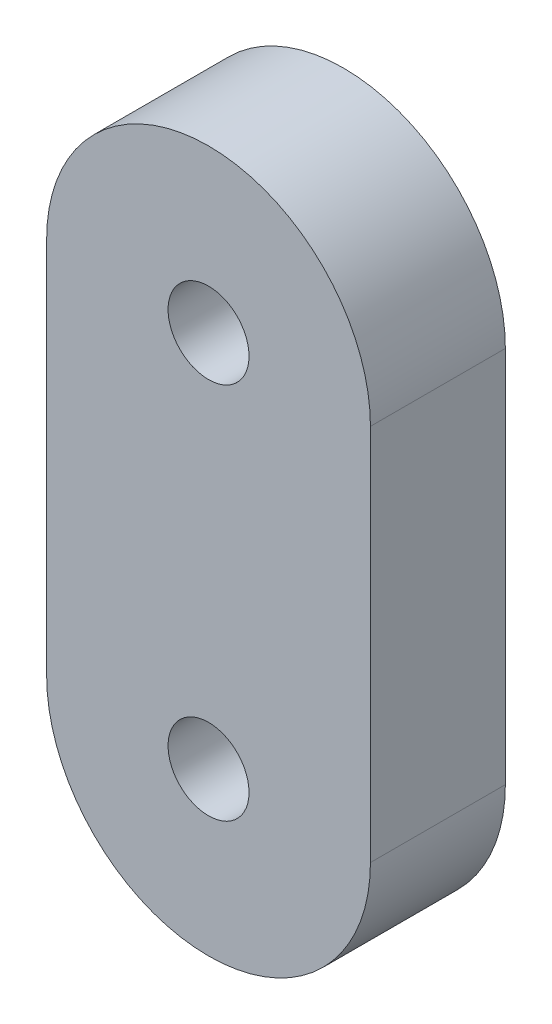
from build123d import *

# Parameters (mm, degrees)
SKETCH1_R           = 1.5
BOSS_EXTRUDE1_DEPTH = 5


with BuildPart() as part:
    # Sketch1 → Boss-Extrude1 (new body)
    with BuildSketch(Plane.XY):
        with BuildLine():
            Line((-6, 0), (-6, 14))
            ThreePointArc((-6, 14), (0, 20), (6, 14))
            Line((6, 14), (6, 0))
            ThreePointArc((6, 0), (0, -6), (-6, 0))
        make_face()
        Circle(SKETCH1_R, mode=Mode.SUBTRACT)
        with Locations((0, 14)):
            Circle(SKETCH1_R, mode=Mode.SUBTRACT)
    extrude(amount=BOSS_EXTRUDE1_DEPTH)


solid = part.part
